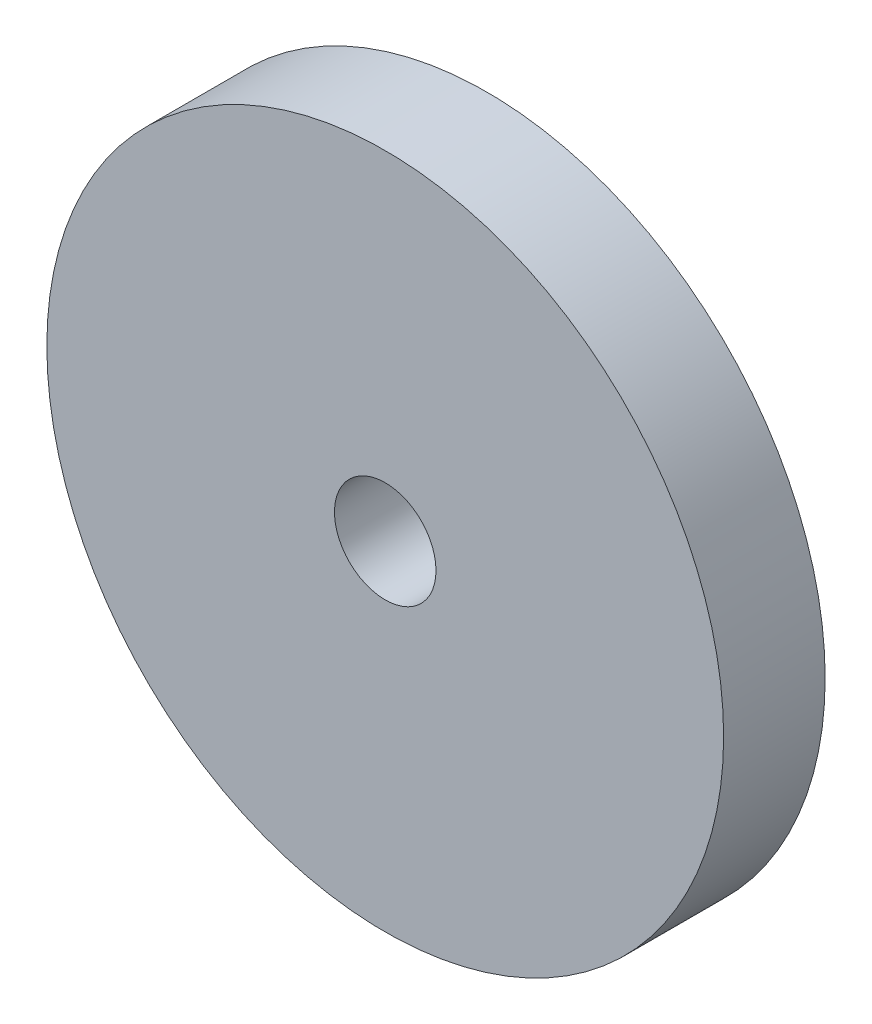
from build123d import *

# Parameters (mm, degrees)
SKETCH1_R           = 10
SKETCH1_R_2         = 1.5
BOSS_EXTRUDE1_DEPTH = 3


with BuildPart() as part:
    # Sketch1 → Boss-Extrude1 (new body)
    with BuildSketch(Plane.XY):
        with Locations((-70.740767531, 50.218379089)):
            Circle(SKETCH1_R)
        with Locations((-70.740767531, 50.218379089)):
            Circle(SKETCH1_R_2, mode=Mode.SUBTRACT)
    extrude(amount=BOSS_EXTRUDE1_DEPTH)


solid = part.part
